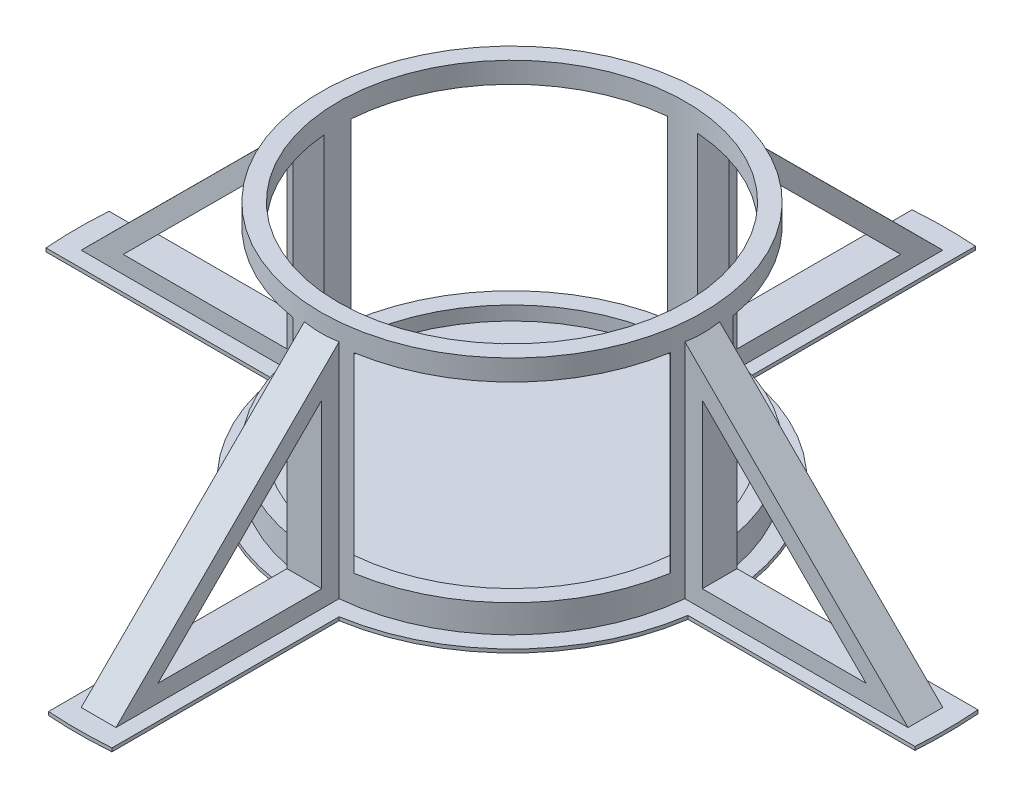
from build123d import *

# Parameters (mm, degrees)
SKETCH2_R           = 55
BOSS_EXTRUDE1_DEPTH = 70
SHELL1_T            = -5
SKETCH4_R           = 125
BOSS_EXTRUDE2_DEPTH = 1
RIB7_REACH          = 192.132
SKETCH3_WALL_W      = 472.644862012
SKETCH3_WALL_H      = 10
CIRPATTERN1_COUNT   = 4
CUT_EXTRUDE1_DEPTH  = 1
CIRPATTERN2_COUNT   = 4
CUT_EXTRUDE2_DEPTH  = 194.455421222
CIRPATTERN3_COUNT   = 4
SKETCH10_W          = 64.387061578
SKETCH10_H          = 55
CUT_EXTRUDE3_DEPTH  = 191.131533418
CIRPATTERN4_COUNT   = 2
CIRPATTERN4_ANGLE   = 90


with BuildPart() as part:
    # Sketch2 → Boss-Extrude1 (new body)
    with BuildSketch(Plane(origin=(0, 0, 0), x_dir=(1, 0, 0), z_dir=(0, 1, 0))):
        with Locations(Location((0, 0, 0), (0, 0, 270))):
            Circle(SKETCH2_R)
    extrude(amount=BOSS_EXTRUDE1_DEPTH)

    # Shell1
    shell1_openings = [part.faces().sort_by_distance(p)[0] for p in [
        (0, 70, 0),
    ]]
    offset(amount=SHELL1_T, openings=shell1_openings, kind=Kind.INTERSECTION)

    # Sketch4 → Boss-Extrude2 (add)
    with BuildSketch(Plane(origin=(0, 0, 0), x_dir=(1, 0, 0), z_dir=(0, 1, 0))):
        with Locations(Location((0, 0, 0), (0, 0, 270))):
            Circle(SKETCH4_R)
    extrude(amount=BOSS_EXTRUDE2_DEPTH)

    # Sketch3 wall → Rib7 (add, up to next)
    with BuildSketch(Plane(origin=(87, 32.90951621, 0), x_dir=(0.708107200971, -0.706104943994, 0), z_dir=(0.706104943994, 0.708107200971, 0)), mode=Mode.PRIVATE) as rib7_sk1:
        Rectangle(SKETCH3_WALL_W, SKETCH3_WALL_H)
    rib7_tool1 = extrude(rib7_sk1.sketch, amount=-RIB7_REACH, mode=Mode.PRIVATE) - part.part
    rib7 = rib7_tool1.solids().sort_by_distance((87, 32.90951621, 0))[0]
    add(rib7)

    # CirPattern1: Rib7 ×4 about axis
    cirpattern1_axis = Axis((0, 0, 0), (0, 1, 0))
    for i in range(1, CIRPATTERN1_COUNT):
        add(rib7.rotate(cirpattern1_axis, i * 360 / CIRPATTERN1_COUNT))

    # Sketch5 → Cut-Extrude1 (cut)
    with BuildSketch(Plane(origin=(0, 1, 0), x_dir=(1, 0, 0), z_dir=(0, 1, 0))):
        with BuildLine():
            Line((9.493142678, -59.24424227), (9.493142678, -129.652922227))
            ThreePointArc((9.493142678, -129.652922227), (92.201319164, -91.645604065), (129.707942461, -8.709171177))
            Line((129.707942461, -8.709171177), (59.364554554, -8.709171177))
            ThreePointArc((59.364554554, -8.709171177), (42.705900876, -42.145059383), (9.493142678, -59.24424227))
        make_face()
    cut_extrude1 = extrude(amount=-CUT_EXTRUDE1_DEPTH, mode=Mode.SUBTRACT)

    # CirPattern2: Cut-Extrude1 ×4 about axis
    cirpattern2_axis = Axis((0, 0, 0), (0, 1, 0))
    for i in range(1, CIRPATTERN2_COUNT):
        add(cut_extrude1.rotate(cirpattern2_axis, i * 360 / CIRPATTERN2_COUNT), mode=Mode.SUBTRACT)

    # Sketch7 → Cut-Extrude2 (cut, through all)
    with BuildSketch(Plane(origin=(5, 0, 0), x_dir=(0, 0, -1), z_dir=(1, 0, 0))):
        Polygon((59.772255751, 52.99919304), (106.904721419, 6), (59.772255751, 6), align=None)
    cut_extrude2 = extrude(amount=-CUT_EXTRUDE2_DEPTH, mode=Mode.SUBTRACT)

    # CirPattern3: Cut-Extrude2 ×4 about axis
    cirpattern3_axis = Axis((0, 0, 0), (0, 1, 0))
    for i in range(1, CIRPATTERN3_COUNT):
        add(cut_extrude2.rotate(cirpattern3_axis, i * 360 / CIRPATTERN3_COUNT), mode=Mode.SUBTRACT)

    # Sketch10 → Cut-Extrude3 (cut, symmetric)
    with BuildSketch(Plane(origin=(0, 0, 0), x_dir=(0.7117650145966598, -3.2873850610052313e-15, 0.7024176563813135), z_dir=(-0.7024176563813135, -3.331131634682351e-15, 0.7117650145966598))):
        with Locations((-0.279356343, 36.5)):
            Rectangle(SKETCH10_W, SKETCH10_H)
    cut_extrude3 = extrude(amount=CUT_EXTRUDE3_DEPTH, both=True, mode=Mode.SUBTRACT)

    # CirPattern4: Cut-Extrude3 ×2 about axis
    cirpattern4_axis = Axis((0, 70, 0), (0, 1, 0))
    for i in range(1, CIRPATTERN4_COUNT):
        add(cut_extrude3.rotate(cirpattern4_axis, i * CIRPATTERN4_ANGLE / (CIRPATTERN4_COUNT - 1)), mode=Mode.SUBTRACT)


solid = part.part
